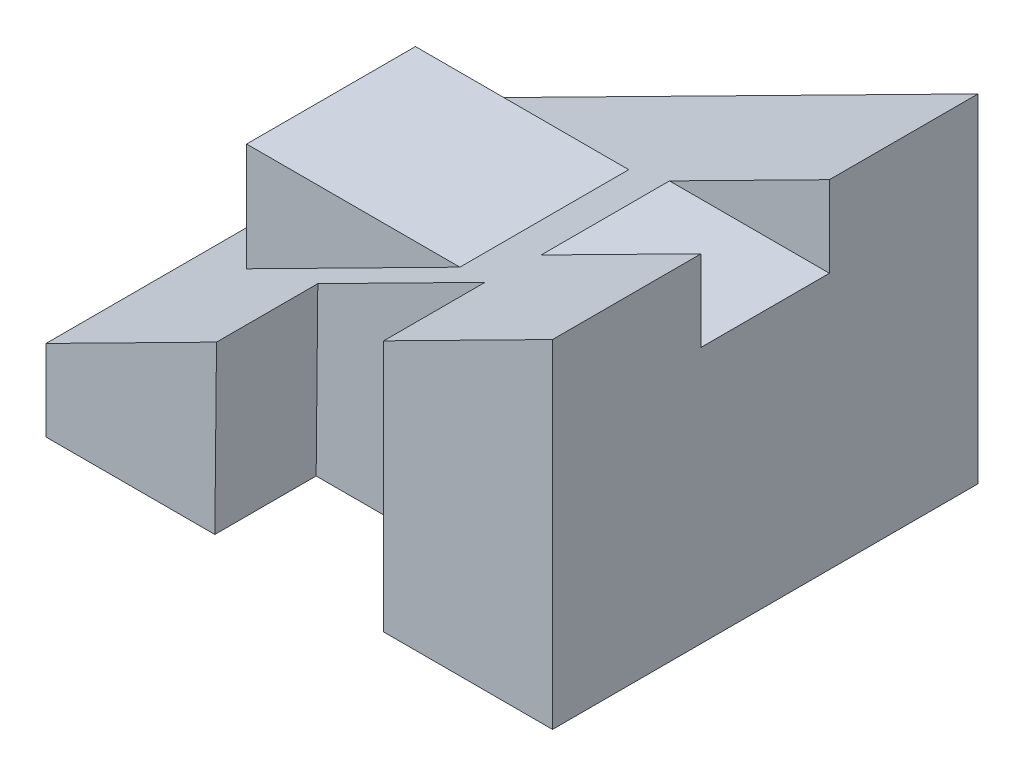
from build123d import *

# Parameters (mm, degrees)
SKETCH2_W           = 75
SKETCH2_H           = 63
BOSS_EXTRUDE1_DEPTH = 50
CUT_EXTRUDE1_DEPTH  = 80
SKETCH6_W           = 19
SKETCH6_H           = 12
CUT_EXTRUDE2_DEPTH  = 80
CUT_EXTRUDE3_DEPTH  = 15
BOSS_EXTRUDE2_DEPTH = 12.5


with BuildPart() as part:
    # Sketch2 → Boss-Extrude1 (new body)
    with BuildSketch(Plane(origin=(0, 0, 0), x_dir=(1, 0, 0), z_dir=(0, 1, 0))):
        Rectangle(SKETCH2_W, SKETCH2_H)
    extrude(amount=BOSS_EXTRUDE1_DEPTH)

    # Sketch4 → Cut-Extrude1 (cut)
    with BuildSketch(Plane.XY.offset(31.5)):
        Polygon((-37.5, 12), (37.5, 50), (-37.5, 50), align=None)
    extrude(amount=-CUT_EXTRUDE1_DEPTH, mode=Mode.SUBTRACT)

    # Sketch6 → Cut-Extrude2 (cut)
    with BuildSketch(Plane(origin=(37.5, 0, 0), x_dir=(0, 0, -1), z_dir=(1, 0, 0))):
        with Locations((0, 44)):
            Rectangle(SKETCH6_W, SKETCH6_H)
    extrude(amount=-CUT_EXTRUDE2_DEPTH, mode=Mode.SUBTRACT)

    # Sketch8 → Cut-Extrude3 (cut)
    with BuildSketch(Plane.XY.offset(31.5)):
        Polygon((-12.253138509, 24.791743155), (-12.5, 0), (12.5, 0), (12.5, 37.333333333), align=None)
    extrude(amount=-CUT_EXTRUDE3_DEPTH, mode=Mode.SUBTRACT)

    # Sketch10 → Boss-Extrude2 (add, symmetric)
    with BuildSketch(Plane.XY):
        Polygon((4.783376681, 33.423577518), (-26.795570688, 17.423577518), (-26.795570688, 33.423577518), align=None)
    extrude(amount=BOSS_EXTRUDE2_DEPTH, both=True)


solid = part.part
